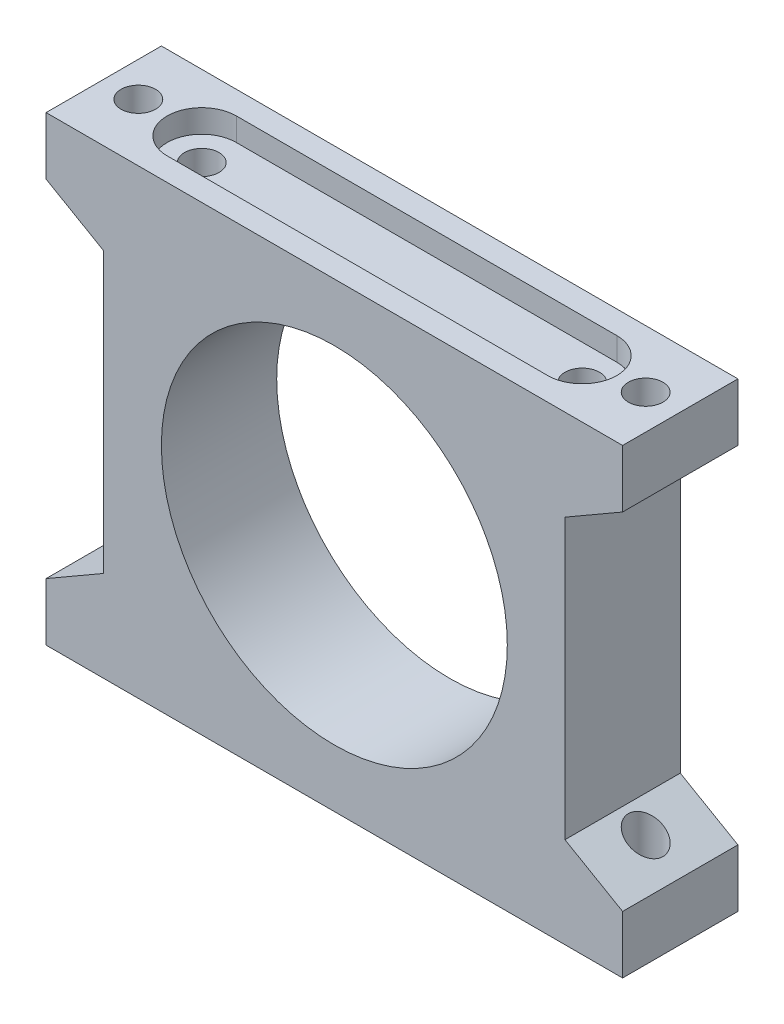
from build123d import *

# Parameters (mm, degrees)
SKETCH_1_R               = 15
EXTRUDE_1_DEPTH          = 10
CUT_EXTRUDE_1_DEPTH      = 49.218253805
CUT_EXTRUDE_1_DEPTH_BACK = 49.218253805
SKETCH_2_R               = 1.5
CUT_EXTRUDE_2_DEPTH      = 2
SKETCH_4_R               = 1.5
CUT_EXTRUDE_3_DEPTH      = 3


with BuildPart() as part:
    # 草图1 → 凸台-拉伸1 (new body)
    with BuildSketch(Plane.XY):
        Polygon((-25, -20), (-25, -15), (-20, -12.113248654), (-20, 12.113248654), (-25, 15), (-25, 20), (25, 20), (25, 15), (20, 12.113248654), (20, -12.113248654), (25, -15), (25, -20), align=None)
        Circle(SKETCH_1_R, mode=Mode.SUBTRACT)
    extrude(amount=EXTRUDE_1_DEPTH)

    # 草图2 → 切除-拉伸1 (cut, two sides: drawn at the far end of the back side and taken through both)
    with BuildSketch(Plane(origin=(0, 20, 0), x_dir=(1, 0, 0), z_dir=(0, 1, 0)).offset(-CUT_EXTRUDE_1_DEPTH_BACK)):
        with Locations((-22, -5)):
            Circle(SKETCH_2_R)
        with Locations((22, -5)):
            Circle(SKETCH_2_R)
    extrude(amount=CUT_EXTRUDE_1_DEPTH + CUT_EXTRUDE_1_DEPTH_BACK, mode=Mode.SUBTRACT)

    # 草图3 → 切除-拉伸2 (cut)
    with BuildSketch(Plane(origin=(0, 20, 0), x_dir=(1, 0, 0), z_dir=(0, 1, 0))):
        with BuildLine():
            Line((-16.5, -2), (16.5, -2))
            ThreePointArc((16.5, -2), (19.5, -5), (16.5, -8))
            Line((16.5, -8), (-16.5, -8))
            ThreePointArc((-16.5, -8), (-19.5, -5), (-16.5, -2))
        make_face()
    cut_extrude_2 = extrude(amount=-CUT_EXTRUDE_2_DEPTH, mode=Mode.SUBTRACT)

    # 草图4 → 切除-拉伸3 (cut)
    with BuildSketch(Plane(origin=(0, 18, 0), x_dir=(1, 0, 0), z_dir=(0, 1, 0))):
        with Locations(Location((-16.5, -5, 0), (0, 0, 180))):
            Circle(SKETCH_4_R)
        with Locations((16.5, -5)):
            Circle(SKETCH_4_R)
    cut_extrude_3 = extrude(amount=-CUT_EXTRUDE_3_DEPTH, mode=Mode.SUBTRACT)

    # 镜向1: 切除-拉伸2, 切除-拉伸3 across plane
    add(cut_extrude_2.mirror(Plane.ZX), mode=Mode.SUBTRACT)
    add(cut_extrude_3.mirror(Plane.ZX), mode=Mode.SUBTRACT)


solid = part.part
